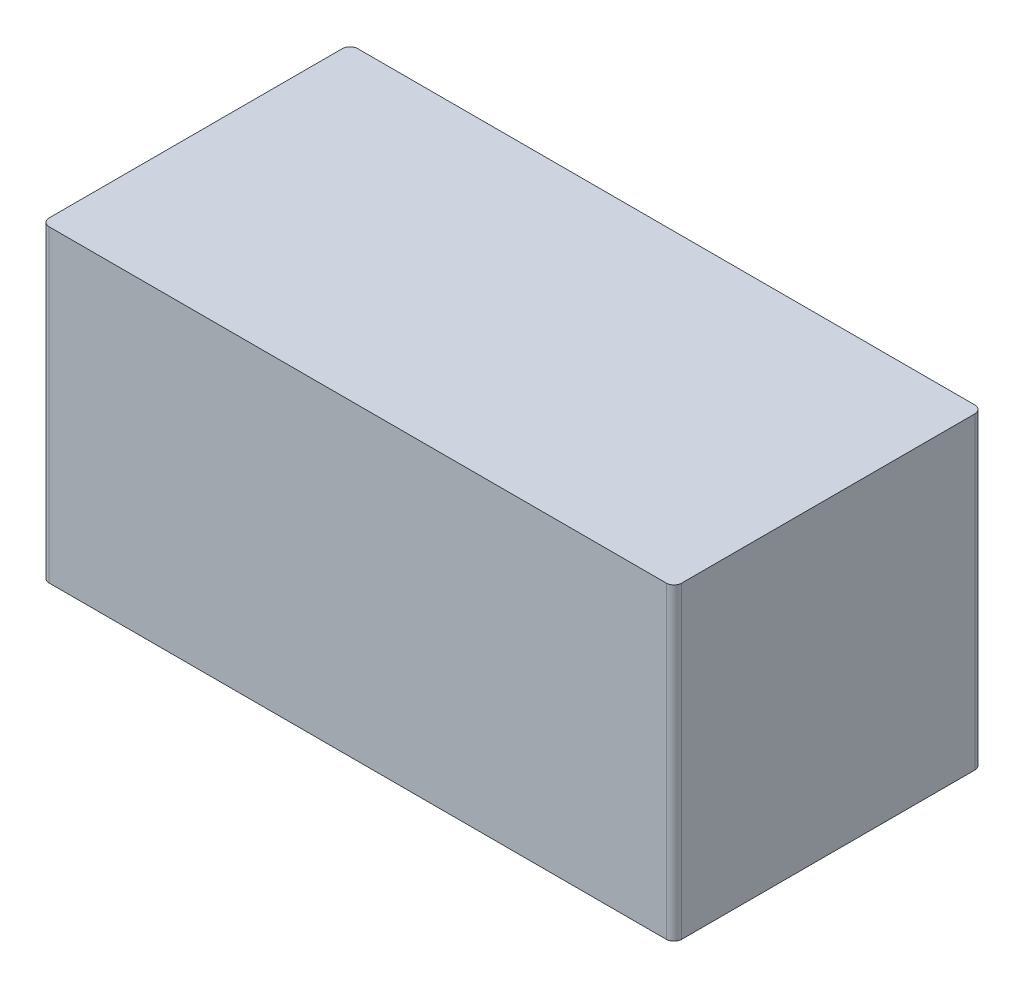
from build123d import *

# Parameters (mm, degrees)
SKETCH1_W           = 41
SKETCH1_H           = 20
BOSS_EXTRUDE1_DEPTH = 20
FILLET1_R           = 0.5


with BuildPart() as part:
    # Sketch1 → Boss-Extrude1 (new body)
    with BuildSketch(Plane(origin=(0, 0, 0), x_dir=(1, 0, 0), z_dir=(0, 1, 0))):
        with Locations((20.5, 10)):
            Rectangle(SKETCH1_W, SKETCH1_H)
    extrude(amount=BOSS_EXTRUDE1_DEPTH)

    # Fillet1
    fillet1_edges = [part.edges().sort_by_distance(p)[0] for p in [
        (0, 10, -20),
        (41, 10, -20),
        (41, 10, 0),
        (0, 10, 0),
    ]]
    fillet(fillet1_edges, radius=FILLET1_R)


solid = part.part
